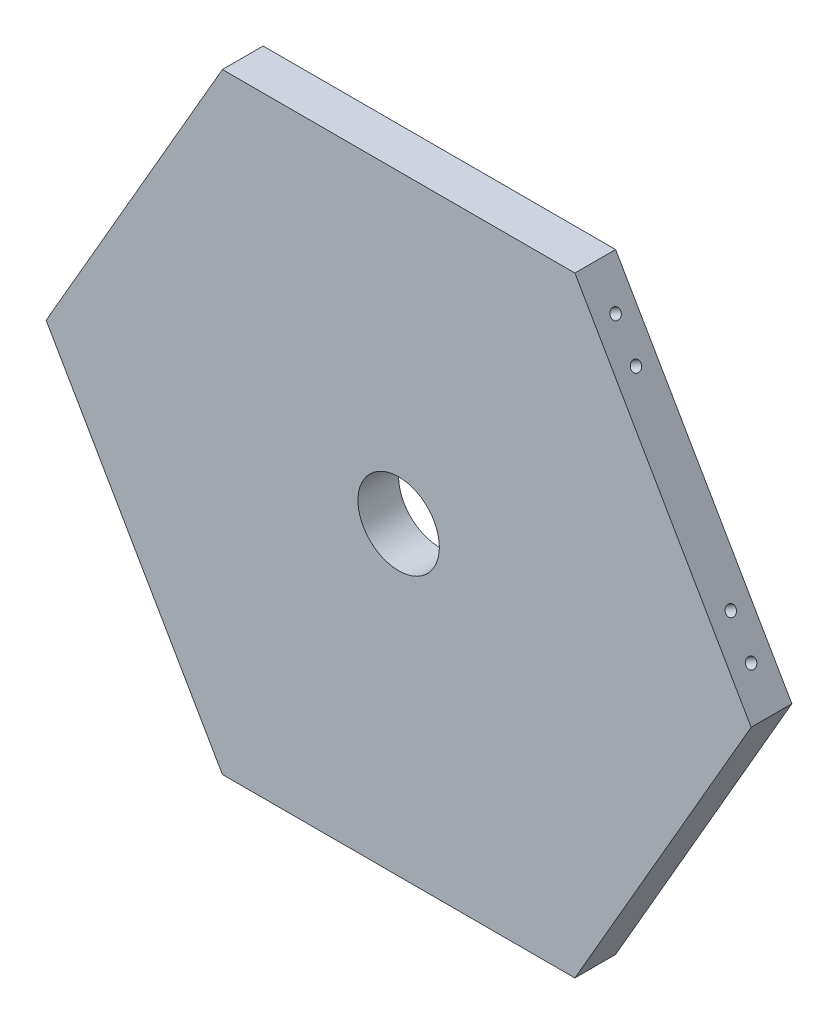
from build123d import *

# Parameters (mm, degrees)
BOSS_EXTRUDE1_DEPTH = 5
SKETCH2_R           = 1.25
CUT_EXTRUDE1_DEPTH  = 10
SKETCH3_R           = 10
CUT_EXTRUDE2_DEPTH  = 116
CIRPATTERN1_COUNT   = 3


with BuildPart() as part:
    # Sketch1 → Boss-Extrude1 (new, symmetric)
    with BuildSketch(Plane.XY):
        Polygon((-43.301270189, -75), (43.301270189, -75), (86.602540378, 0), (43.301270189, 75), (-43.301270189, 75), (-86.602540378, 0), align=None)
    extrude(amount=BOSS_EXTRUDE1_DEPTH, both=True)

    # Sketch2 → Cut-Extrude1 (cut)
    with BuildSketch(Plane.XZ.offset(75)):
        with Locations(Location((-33.301270189, 0, 0), (0, 0, 270))):
            Circle(SKETCH2_R)
        with Locations(Location((-23.301270189, 0, 0), (0, 0, 270))):
            Circle(SKETCH2_R)
        with Locations(Location((23.301270189, 0, 0), (0, 0, 90))):
            Circle(SKETCH2_R)
        with Locations(Location((33.301270189, 0, 0), (0, 0, 90))):
            Circle(SKETCH2_R)
    cut_extrude1 = extrude(amount=-CUT_EXTRUDE1_DEPTH, mode=Mode.SUBTRACT)

    # Sketch3 → Cut-Extrude2 (cut, through all)
    with BuildSketch(Plane.XY.offset(5)):
        Circle(SKETCH3_R)
    extrude(amount=-CUT_EXTRUDE2_DEPTH, mode=Mode.SUBTRACT)

    # CirPattern1: Cut-Extrude1 ×3 about axis
    cirpattern1_axis = Axis((0, 0, 0), (0, 0, 1))
    for i in range(1, CIRPATTERN1_COUNT):
        add(cut_extrude1.rotate(cirpattern1_axis, i * 360 / CIRPATTERN1_COUNT), mode=Mode.SUBTRACT)


solid = part.part
